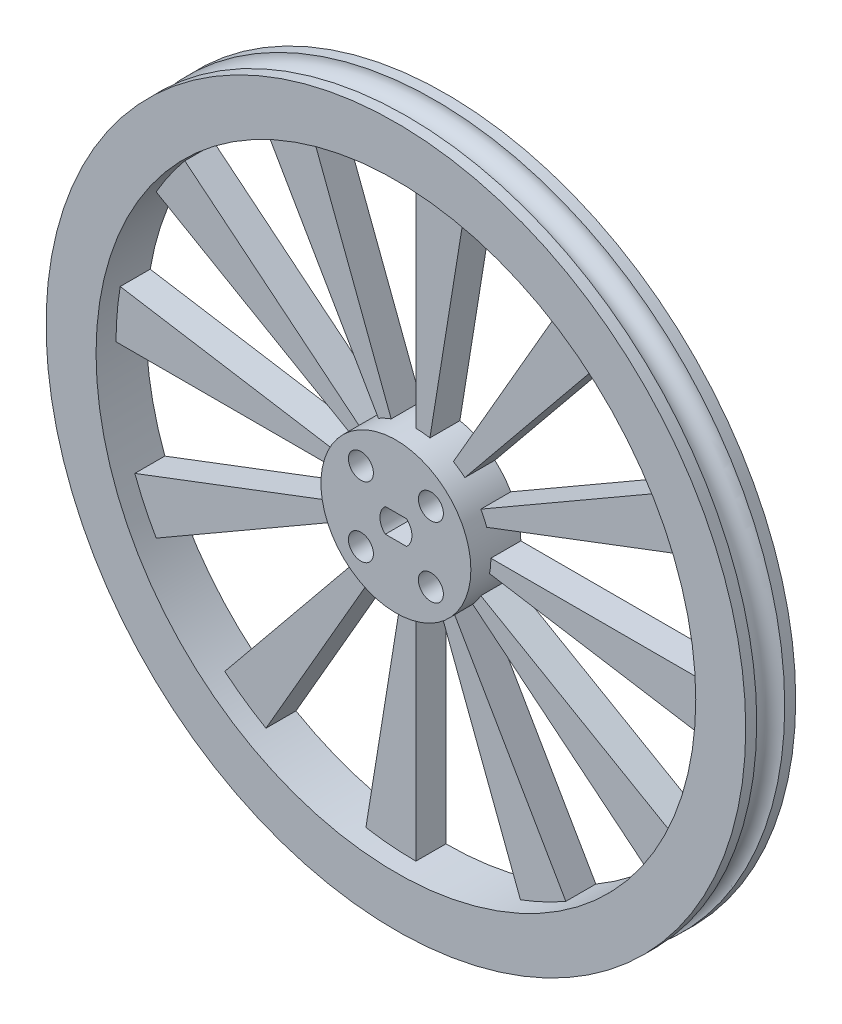
from build123d import *

# Parameters (mm, degrees)
BOSS_EXTRUDE1_DEPTH        = 3.81
BOSS_EXTRUDE1_DEPTH_BACK   = 2.54
SKETCH1_R                  = 44.45
SKETCH1_R_2                = 38.1
BOSS_EXTRUDE1_2_DEPTH      = 3.81
BOSS_EXTRUDE1_2_DEPTH_BACK = 2.54
SKETCH1_R_3                = 9.525
BOSS_EXTRUDE2_DEPTH        = 1.27
BOSS_EXTRUDE2_DEPTH_BACK   = 2.54
CUT_EXTRUDE1_DEPTH         = 5.08
CUT_EXTRUDE1_DEPTH_BACK    = 5.08
SKETCH4_R                  = 1.5875
SKETCH6_R                  = 1.778


with BuildPart() as part:
    # Sketch1 → Boss-Extrude1 (new, two sides: drawn at the far end of the back side and taken through both)
    with BuildSketch(Plane.XY.offset(-BOSS_EXTRUDE1_DEPTH_BACK)):
        Circle(SKETCH1_R)
        Circle(SKETCH1_R_2, mode=Mode.SUBTRACT)
    extrude(amount=BOSS_EXTRUDE1_DEPTH + BOSS_EXTRUDE1_DEPTH_BACK)



with BuildPart() as body_2:
    # Sketch1 → Boss-Extrude1 2 (new, two sides: drawn at the far end of the back side and taken through both)
    with BuildSketch(Plane.XY.offset(-BOSS_EXTRUDE1_2_DEPTH_BACK)):
        Circle(SKETCH1_R_3)
        with BuildLine():
            Line((-1.344041666, 1.524), (1.344041666, 1.524))
            ThreePointArc((1.344041666, 1.524), (2.032, 0), (1.344041666, -1.524))
            Line((1.344041666, -1.524), (-1.344041666, -1.524))
            ThreePointArc((-1.344041666, -1.524), (-2.032, 0), (-1.344041666, 1.524))
        make_face(mode=Mode.SUBTRACT)
    extrude(amount=BOSS_EXTRUDE1_2_DEPTH + BOSS_EXTRUDE1_2_DEPTH_BACK)


with BuildPart() as part_1:
    add(part.part)

    add(body_2.part)  # Boss-Extrude2 merges body 2
    # Sketch2 → Boss-Extrude2 (add, two sides: drawn at the far end of the back side and taken through both)
    with BuildSketch(Plane.XY.offset(-BOSS_EXTRUDE2_DEPTH_BACK)):
        with BuildLine():
            Line((0, 9.525), (0, 38.1))
            ThreePointArc((0, 38.1), (3.186160517, 37.966542918), (6.35, 37.567106623))
            Line((6.35, 37.567106623), (1.778, 9.357582006))
            Line((1.778, 9.357582006), (0, 9.525))
        make_face()
        with BuildLine():
            Line((4.7625, 8.248891971), (19.05, 32.995567884))
            ThreePointArc((19.05, 32.995567884), (21.742567407, 31.286910403), (24.282814625, 29.359068682))
            Line((24.282814625, 29.359068682), (6.218584171, 7.214903735))
            Line((6.218584171, 7.214903735), (4.7625, 8.248891971))
        make_face()
        with BuildLine():
            Line((8.248891971, 4.7625), (32.995567884, 19.05))
            ThreePointArc((32.995567884, 19.05), (34.473070919, 16.223975511), (35.709068682, 13.284291997))
            Line((35.709068682, 13.284291997), (8.992903735, 3.138997835))
            Line((8.992903735, 3.138997835), (8.248891971, 4.7625))
        make_face()
        with BuildLine():
            Line((9.525, 0), (38.1, 0))
            ThreePointArc((38.1, 0), (37.966542918, -3.186160517), (37.567106623, -6.35))
            Line((37.567106623, -6.35), (9.357582006, -1.778))
            Line((9.357582006, -1.778), (9.525, 0))
        make_face()
        with BuildLine():
            Line((8.248891971, -4.7625), (32.995567884, -19.05))
            ThreePointArc((32.995567884, -19.05), (31.286910403, -21.742567407), (29.359068682, -24.282814625))
            Line((29.359068682, -24.282814625), (7.214903735, -6.218584171))
            Line((7.214903735, -6.218584171), (8.248891971, -4.7625))
        make_face()
        with BuildLine():
            Line((4.7625, -8.248891971), (19.05, -32.995567884))
            ThreePointArc((19.05, -32.995567884), (16.223975511, -34.473070919), (13.284291997, -35.709068682))
            Line((13.284291997, -35.709068682), (3.138997835, -8.992903735))
            Line((3.138997835, -8.992903735), (4.7625, -8.248891971))
        make_face()
        with BuildLine():
            Line((0, -9.525), (0, -38.1))
            ThreePointArc((0, -38.1), (-3.186160517, -37.966542918), (-6.35, -37.567106623))
            Line((-6.35, -37.567106623), (-1.778, -9.357582006))
            Line((-1.778, -9.357582006), (0, -9.525))
        make_face()
        with BuildLine():
            Line((-4.7625, -8.248891971), (-19.05, -32.995567884))
            ThreePointArc((-19.05, -32.995567884), (-21.742567407, -31.286910403), (-24.282814625, -29.359068682))
            Line((-24.282814625, -29.359068682), (-6.218584171, -7.214903735))
            Line((-6.218584171, -7.214903735), (-4.7625, -8.248891971))
        make_face()
        with BuildLine():
            Line((-8.248891971, -4.7625), (-32.995567884, -19.05))
            ThreePointArc((-32.995567884, -19.05), (-34.473070919, -16.223975511), (-35.709068682, -13.284291997))
            Line((-35.709068682, -13.284291997), (-8.992903735, -3.138997835))
            Line((-8.992903735, -3.138997835), (-8.248891971, -4.7625))
        make_face()
        with BuildLine():
            Line((-9.525, 0), (-38.1, 0))
            ThreePointArc((-38.1, 0), (-37.966542918, 3.186160517), (-37.567106623, 6.35))
            Line((-37.567106623, 6.35), (-9.357582006, 1.778))
            Line((-9.357582006, 1.778), (-9.525, 0))
        make_face()
        with BuildLine():
            Line((-8.248891971, 4.7625), (-32.995567884, 19.05))
            ThreePointArc((-32.995567884, 19.05), (-31.286910403, 21.742567407), (-29.359068682, 24.282814625))
            Line((-29.359068682, 24.282814625), (-7.214903735, 6.218584171))
            Line((-7.214903735, 6.218584171), (-8.248891971, 4.7625))
        make_face()
        with BuildLine():
            Line((-4.7625, 8.248891971), (-19.05, 32.995567884))
            ThreePointArc((-19.05, 32.995567884), (-16.223975511, 34.473070919), (-13.284291997, 35.709068682))
            Line((-13.284291997, 35.709068682), (-3.138997835, 8.992903735))
            Line((-3.138997835, 8.992903735), (-4.7625, 8.248891971))
        make_face()
    extrude(amount=BOSS_EXTRUDE2_DEPTH + BOSS_EXTRUDE2_DEPTH_BACK)

    # Sketch4 → Cut-Extrude1 (cut, two sides: drawn at the far end of the back side and taken through both)
    with BuildSketch(Plane.XY.offset(-CUT_EXTRUDE1_DEPTH_BACK)):
        with Locations((-4.445, 4.445)):
            Circle(SKETCH4_R)
        with Locations((4.445, 4.445)):
            Circle(SKETCH4_R)
        with Locations((4.445, -4.445)):
            Circle(SKETCH4_R)
        with Locations((-4.445, -4.445)):
            Circle(SKETCH4_R)
    extrude(amount=CUT_EXTRUDE1_DEPTH + CUT_EXTRUDE1_DEPTH_BACK, mode=Mode.SUBTRACT)

    # Sketch6 → Cut-Revolve1 (revolve, cut)
    with BuildSketch(Plane(origin=(0, 0, 0), x_dir=(0, 0, -1), z_dir=(1, 0, 0)), mode=Mode.PRIVATE) as cut_revolve1_sk:
        with Locations((-0.635, 44.45)):
            Circle(SKETCH6_R)
    revolve(cut_revolve1_sk.sketch.rotate(Axis((0, 0, 17.923706186), (0, 0, -1)), 90), axis=Axis((0, 0, 17.923706186), (0, 0, -1)), mode=Mode.SUBTRACT)


solid = part_1.part
